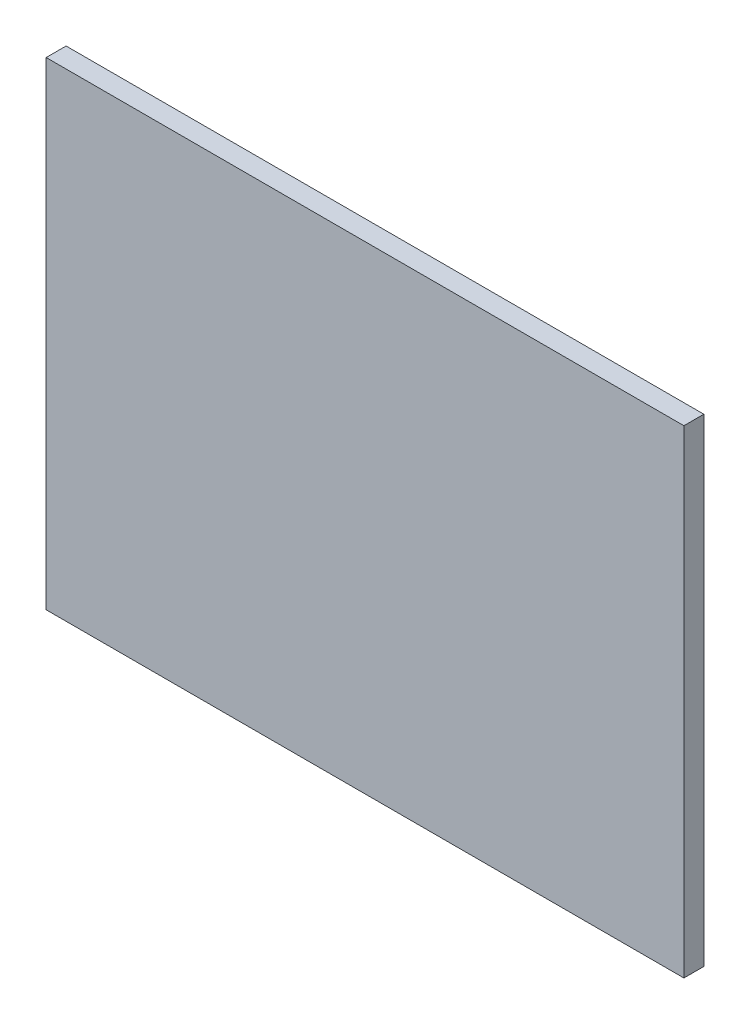
from build123d import *

# Parameters (mm, degrees)
SKETCH1_W           = 50.8
SKETCH1_H           = 38.1
BOSS_EXTRUDE1_DEPTH = 1.5875


with BuildPart() as part:
    # Sketch1 → Boss-Extrude1 (new body)
    with BuildSketch(Plane.XY):
        Rectangle(SKETCH1_W, SKETCH1_H)
    extrude(amount=BOSS_EXTRUDE1_DEPTH)


solid = part.part
